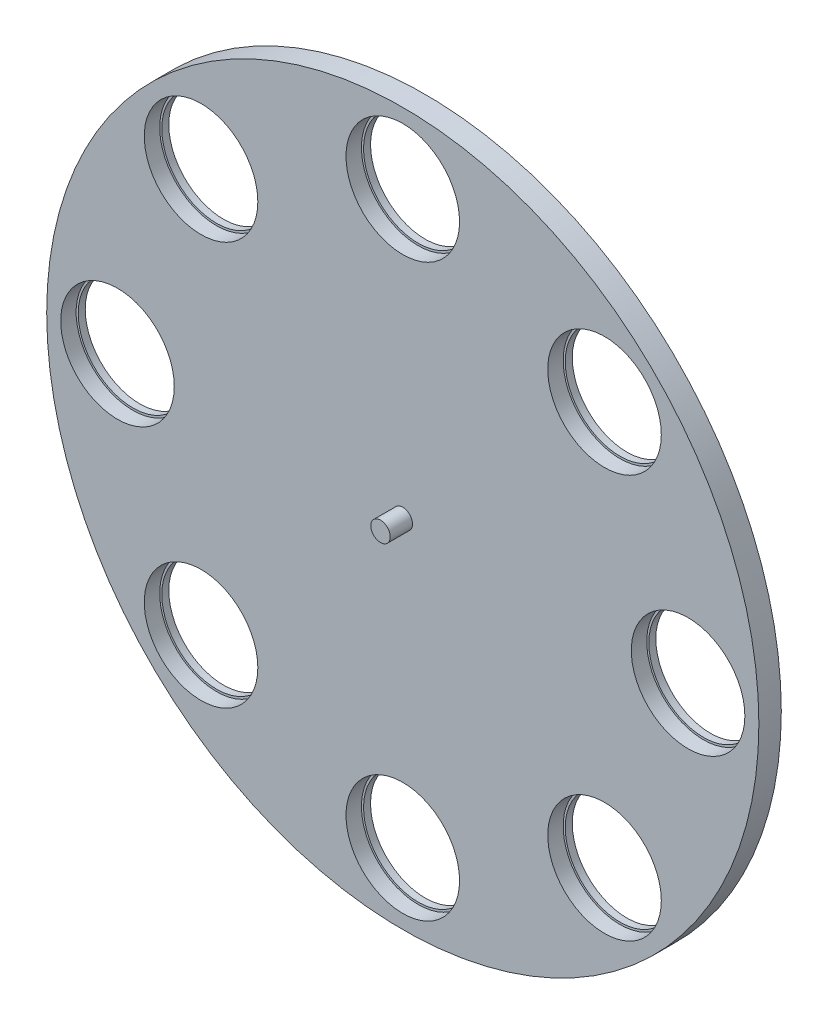
from build123d import *

# Parameters (mm, degrees)
SKETCH1_R           = 25.4
SKETCH1_R_2         = 4.05
BOSS_EXTRUDE1_DEPTH = 1.1
SKETCH2_R           = 0.69375
BOSS_EXTRUDE2_DEPTH = 1.5875
BOSS_EXTRUDE3_START = 0.5
SKETCH3_R           = 25.4
SKETCH3_R_2         = 3.9
BOSS_EXTRUDE3_DEPTH = 0.5


with BuildPart() as part:
    # Sketch1 → Boss-Extrude1 (new body)
    with BuildSketch(Plane.XY):
        Circle(SKETCH1_R)
        with Locations((0, 20.35)):
            Circle(SKETCH1_R_2, mode=Mode.SUBTRACT)
        with Locations((14.389622997, 14.389622997)):
            Circle(SKETCH1_R_2, mode=Mode.SUBTRACT)
        with Locations((20.35, 0)):
            Circle(SKETCH1_R_2, mode=Mode.SUBTRACT)
        with Locations((14.389622997, -14.389622997)):
            Circle(SKETCH1_R_2, mode=Mode.SUBTRACT)
        with Locations((0, -20.35)):
            Circle(SKETCH1_R_2, mode=Mode.SUBTRACT)
        with Locations((-14.389622997, -14.389622997)):
            Circle(SKETCH1_R_2, mode=Mode.SUBTRACT)
        with Locations((-20.35, 0)):
            Circle(SKETCH1_R_2, mode=Mode.SUBTRACT)
        with Locations((-14.389622997, 14.389622997)):
            Circle(SKETCH1_R_2, mode=Mode.SUBTRACT)
    extrude(amount=BOSS_EXTRUDE1_DEPTH)

    # Sketch2 → Boss-Extrude2 (add)
    with BuildSketch(Plane.XY.offset(1.1)):
        Circle(SKETCH2_R)
    extrude(amount=BOSS_EXTRUDE2_DEPTH)

    # Sketch3 → Boss-Extrude3 (add)
    with BuildSketch(Plane(origin=(0, 0, 0), x_dir=(-1, 0, 0), z_dir=(0, 0, -1)).offset(BOSS_EXTRUDE3_START)):
        Circle(SKETCH3_R)
        with Locations((0, 20.35)):
            Circle(SKETCH3_R_2, mode=Mode.SUBTRACT)
        with Locations((14.389622997, 14.389622997)):
            Circle(SKETCH3_R_2, mode=Mode.SUBTRACT)
        with Locations((20.35, 0)):
            Circle(SKETCH3_R_2, mode=Mode.SUBTRACT)
        with Locations((14.389622997, -14.389622997)):
            Circle(SKETCH3_R_2, mode=Mode.SUBTRACT)
        with Locations((0, -20.35)):
            Circle(SKETCH3_R_2, mode=Mode.SUBTRACT)
        with Locations((-14.389622997, -14.389622997)):
            Circle(SKETCH3_R_2, mode=Mode.SUBTRACT)
        with Locations((-20.35, 0)):
            Circle(SKETCH3_R_2, mode=Mode.SUBTRACT)
        with Locations((-14.389622997, 14.389622997)):
            Circle(SKETCH3_R_2, mode=Mode.SUBTRACT)
    extrude(amount=-BOSS_EXTRUDE3_DEPTH)


solid = part.part
